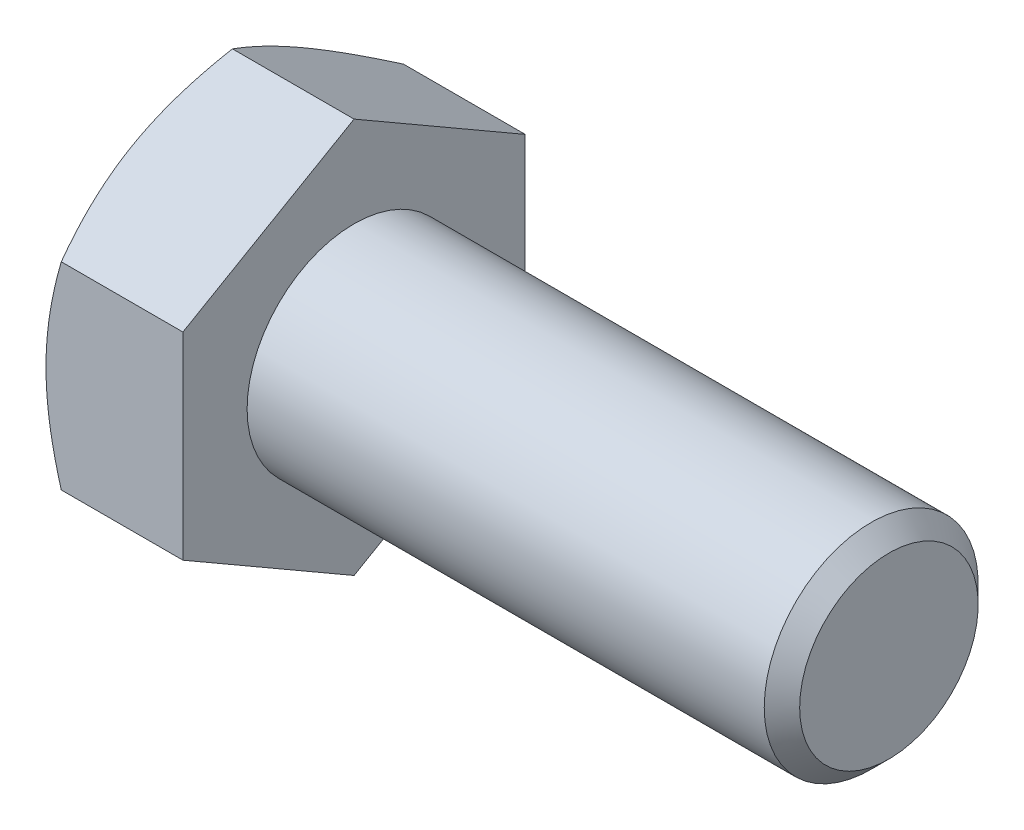
from build123d import *

# Parameters (mm, degrees)
BASEHEAD_DEPTH = 6.4


with BuildPart() as part:
    # Sketch1 → BaseHead (new body)
    with BuildSketch(Plane(origin=(0, 0, 0), x_dir=(0, 0, -1), z_dir=(1, 0, 0))):
        Polygon((8, 4.618802154), (8, -4.618802154), (0, -9.237604307), (-8, -4.618802154), (-8, 4.618802154), (0, 9.237604307), align=None)
    extrude(amount=BASEHEAD_DEPTH)

    # BodySke → BaseBody (revolve)
    with BuildSketch(Plane.XY, mode=Mode.PRIVATE) as basebody_sk:
        Polygon((0, 0), (31.4, 0), (31.4, 4.172), (30.572, 5), (0, 5), align=None)
    revolve(basebody_sk.sketch.rotate(Axis((0, 0, 0), (1, 0, 0)), 90), axis=Axis((0, 0, 0), (1, 0, 0)))

    # Sketch3 → HeadChamfer (revolve, cut)
    with BuildSketch(Plane.XY):
        Polygon((0, 8), (3.601282526, 14.237604307), (3.601282526, 19.237604307), (-10, 19.237604307), (-10, 8), align=None)
    revolve(axis=Axis((0, 0, 0), (1, 0, 0)), mode=Mode.SUBTRACT)


solid = part.part
